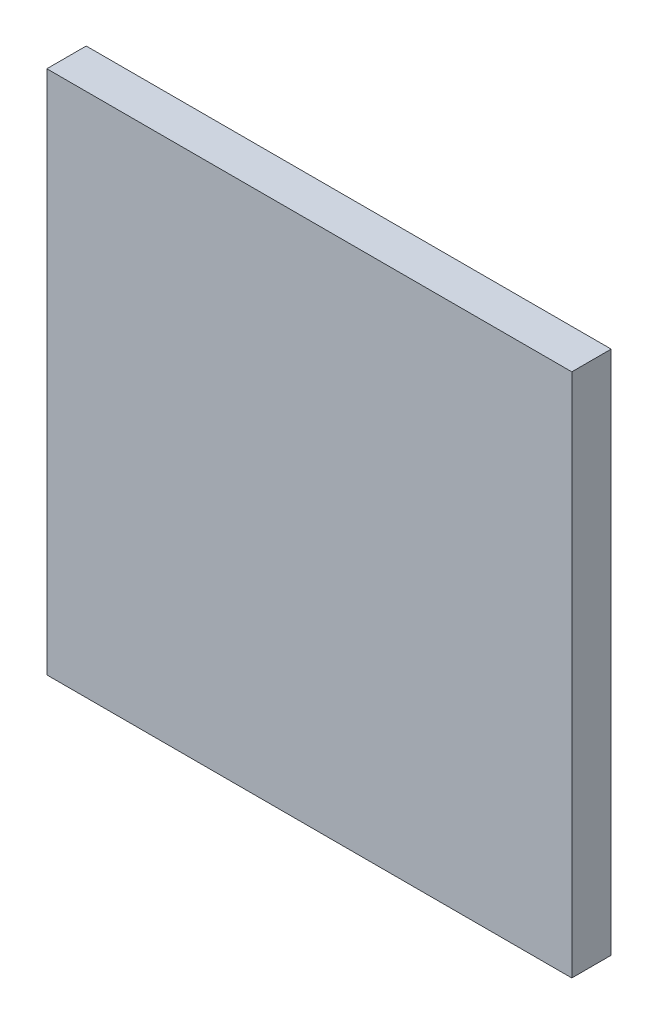
from build123d import *

# Parameters (mm, degrees)
SKETCH1_W           = 200
SKETCH1_H           = 200
BOSS_EXTRUDE1_DEPTH = 15


with BuildPart() as part:
    # Sketch1 → Boss-Extrude1 (new body)
    with BuildSketch(Plane.XY):
        Rectangle(SKETCH1_W, SKETCH1_H)
    extrude(amount=BOSS_EXTRUDE1_DEPTH)


solid = part.part
